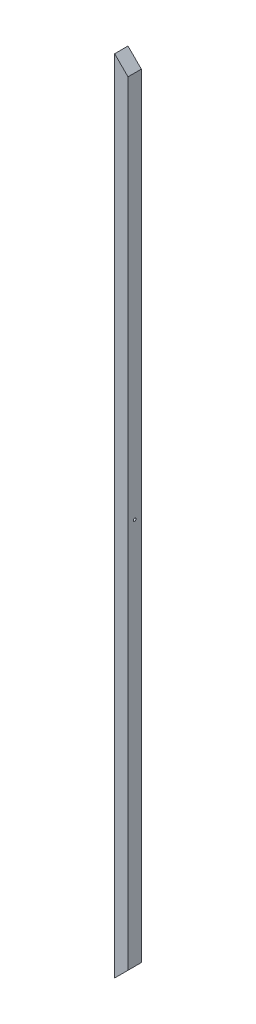
from build123d import *

# Parameters (mm, degrees)
SKETCH_1_W          = 50
SKETCH_1_H          = 50
EXTRUDE_1_DEPTH     = 3000
CUT_EXTRUDE_1_DEPTH = 3000
SKETCH_4_R          = 5
CUT_EXTRUDE_2_DEPTH = 50


with BuildPart() as part:
    # Эскиз1 → Бобышка-Вытянуть1 (new body)
    with BuildSketch(Plane(origin=(0, 0, 0), x_dir=(1, 0, 0), z_dir=(0, 1, 0))):
        Rectangle(SKETCH_1_W, SKETCH_1_H)
    extrude(amount=EXTRUDE_1_DEPTH)

    # Эскиз2 → Вырез-Вытянуть1 (cut)
    with BuildSketch(Plane.XY.offset(25)):
        Polygon((25, 3000), (-25, 3000), (25, 2950), align=None)
        Polygon((25, 0), (-25, 0), (25, 50), align=None)
    extrude(amount=-CUT_EXTRUDE_1_DEPTH, mode=Mode.SUBTRACT)

    # Эскиз4 → Вырез-Вытянуть2 (cut)
    with BuildSketch(Plane.ZY.offset(25)):
        with Locations((0, 1500)):
            Circle(SKETCH_4_R)
    extrude(amount=-CUT_EXTRUDE_2_DEPTH, mode=Mode.SUBTRACT)


solid = part.part
